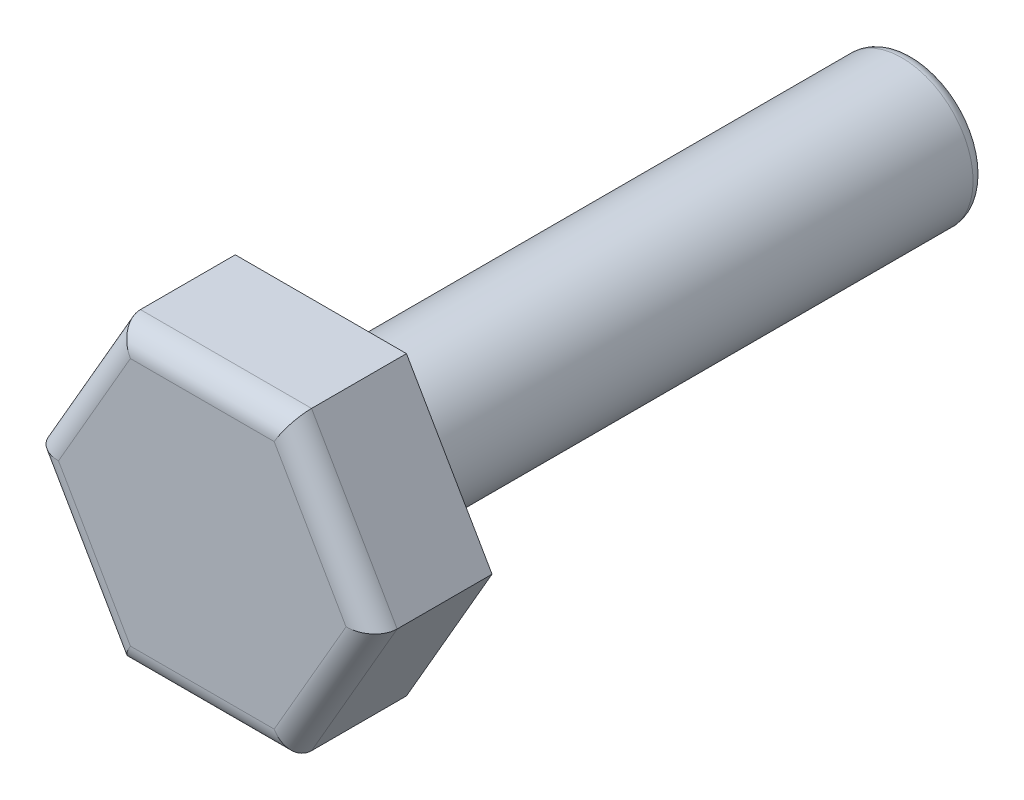
from build123d import *

# Parameters (mm, degrees)
SKETCH_1_R      = 6
EXTRUDE_1_DEPTH = 60
EXTRUDE_2_DEPTH = 10
FILLET_1_R      = 2
FILLET_2_R      = 1


with BuildPart() as part:
    # 草图1 → 凸台-拉伸1 (new body)
    with BuildSketch(Plane.XY):
        Circle(SKETCH_1_R)
    extrude(amount=EXTRUDE_1_DEPTH)

    # 草图3 → 凸台-拉伸2 (add)
    with BuildSketch(Plane.XY.offset(60)):
        Polygon((7.216878365, -12.5), (14.43375673, 0), (7.216878365, 12.5), (-7.216878365, 12.5), (-14.43375673, 0), (-7.216878365, -12.5), align=None)
    extrude(amount=-EXTRUDE_2_DEPTH)

    # 圆角1
    fillet_1_edges = [part.edges().sort_by_distance(p)[0] for p in [
        (0, -12.5, 60),
        (10.825317547, -6.25, 60),
        (10.825317547, 6.25, 60),
        (0, 12.5, 60),
        (-10.825317547, 6.25, 60),
        (-10.825317547, -6.25, 60),
    ]]
    fillet(fillet_1_edges, radius=FILLET_1_R)

    # 圆角2
    fillet_2_edges = [part.edges().sort_by_distance(p)[0] for p in [
        (-6, 0, 0),
    ]]
    fillet(fillet_2_edges, radius=FILLET_2_R)


solid = part.part
